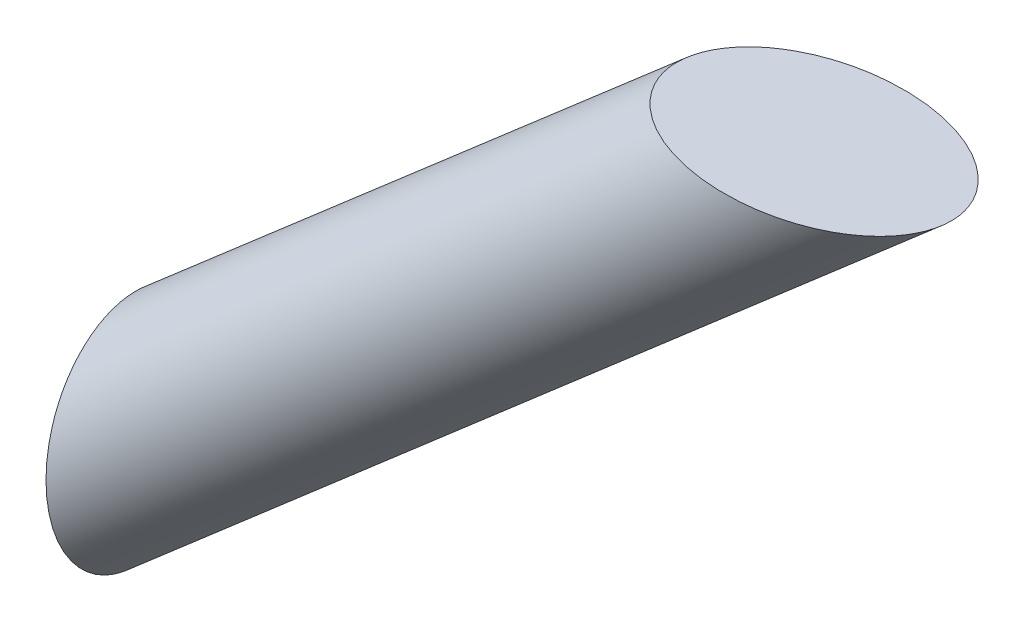
from build123d import *

# Parameters (mm, degrees)
CUT_EXTRUDE1_DEPTH      = 206.849628346
CUT_EXTRUDE1_DEPTH_BACK = 206.849628346
CUT_EXTRUDE2_DEPTH      = 185.85731066
CUT_EXTRUDE2_DEPTH_BACK = 185.85731066


with BuildPart() as part:
    # Sketch1 → Revolve-Thin1 (revolve)
    with BuildSketch(Plane.XY, mode=Mode.PRIVATE) as revolve_thin1_sk:
        Polygon((135.605846103, 117.01106453), (-94.788032894, -82.542688932), (-78.158553439, -101.742178848), (152.235325558, 97.811574614), align=None)
    revolve(revolve_thin1_sk.sketch.rotate(Axis((135.605846103, 117.01106453, 0), (-0.7558854297800033, -0.6547039155574831, 0)), 180), axis=Axis((135.605846103, 117.01106453, 0), (-0.7558854297800033, -0.6547039155574831, 0)))

    # Sketch2 → Cut-Extrude1 (cut, two sides: drawn at the far end of the back side and taken through both)
    with BuildSketch(Plane.XY.offset(-CUT_EXTRUDE1_DEPTH_BACK)):
        Polygon((180.039707564, 97.811574614), (7.480130989, 97.811574614), (101.41164362, 186.9937411), align=None)
    extrude(amount=CUT_EXTRUDE1_DEPTH + CUT_EXTRUDE1_DEPTH_BACK, mode=Mode.SUBTRACT)

    # Sketch3 → Cut-Extrude2 (cut, two sides: drawn at the far end of the back side and taken through both)
    with BuildSketch(Plane.XY.offset(-CUT_EXTRUDE2_DEPTH_BACK)):
        Polygon((-78.158553439, -101.742178848), (-78.158553439, 0), (-164.424224952, -9.260462321), (-121.291389196, -114.506813698), align=None)
    extrude(amount=CUT_EXTRUDE2_DEPTH + CUT_EXTRUDE2_DEPTH_BACK, mode=Mode.SUBTRACT)


solid = part.part
